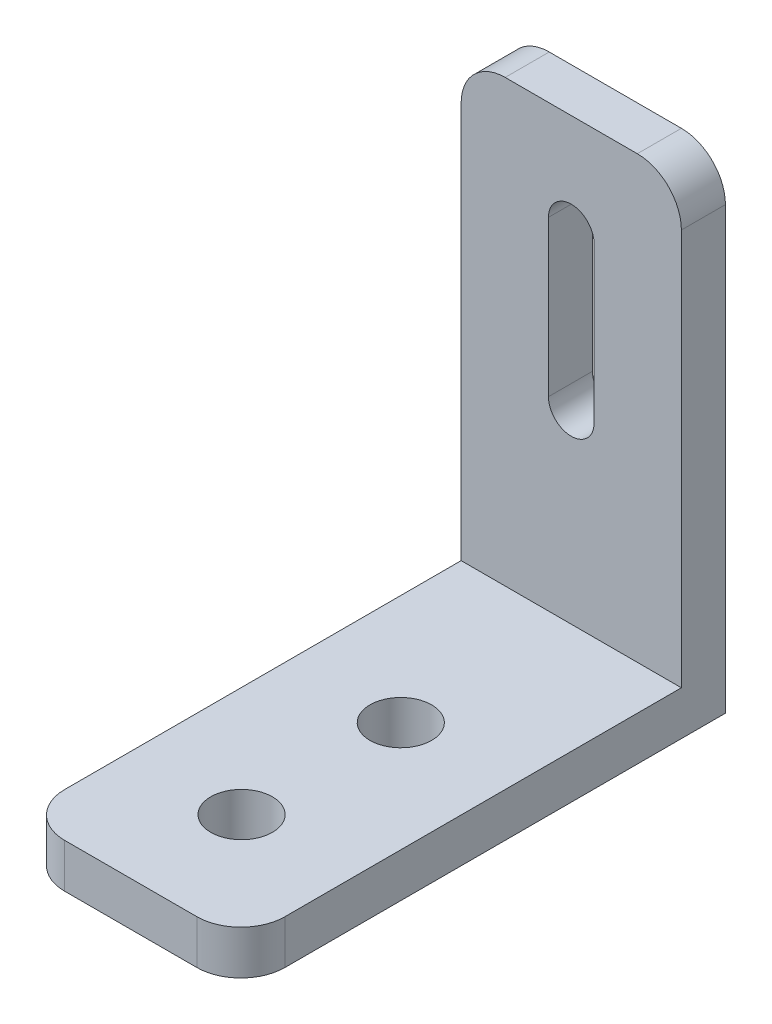
from build123d import *

# Parameters (mm, degrees)
EXTRUDE_THIN1_DEPTH = 50
FILLET1_R           = 10
CUT_EXTRUDE1_DEPTH  = 10
SKETCH3_R           = 7
CUT_EXTRUDE2_DEPTH  = 10


with BuildPart() as part:
    # Sketch1 → Extrude-Thin1 (new body)
    with BuildSketch(Plane(origin=(0, 0, 0), x_dir=(0, 0, -1), z_dir=(1, 0, 0))):
        Polygon((0, 0), (100, 0), (100, 100), (110, 100), (110, -10), (0, -10), align=None)
    extrude(amount=EXTRUDE_THIN1_DEPTH)

    # Fillet1
    fillet1_edges = [part.edges().sort_by_distance(p)[0] for p in [
        (50, -5, 0),
        (0, -5, 0),
        (0, 100, -105),
        (50, 100, -105),
    ]]
    fillet(fillet1_edges, radius=FILLET1_R)

    # Sketch2 → Cut-Extrude1 (cut)
    with BuildSketch(Plane.XY.offset(-100)):
        with BuildLine():
            Line((30.184472994, 77.392944228), (30.184472994, 42.136183713))
            ThreePointArc((30.184472994, 42.136183713), (25, 36.951710719), (19.815527006, 42.136183713))
            Line((19.815527006, 42.136183713), (19.815527006, 77.392944228))
            ThreePointArc((19.815527006, 77.392944228), (25, 82.577417222), (30.184472994, 77.392944228))
        make_face()
    extrude(amount=-CUT_EXTRUDE1_DEPTH, mode=Mode.SUBTRACT)

    # Sketch3 → Cut-Extrude2 (cut)
    with BuildSketch(Plane(origin=(0, 0, 0), x_dir=(1, 0, 0), z_dir=(0, 1, 0))):
        with Locations(Location((25, 25.15267025, 0), (0, 0, 270))):
            Circle(SKETCH3_R)
        with Locations(Location((25, 61.300395832, 0), (0, 0, 270))):
            Circle(SKETCH3_R)
    extrude(amount=-CUT_EXTRUDE2_DEPTH, mode=Mode.SUBTRACT)


solid = part.part
